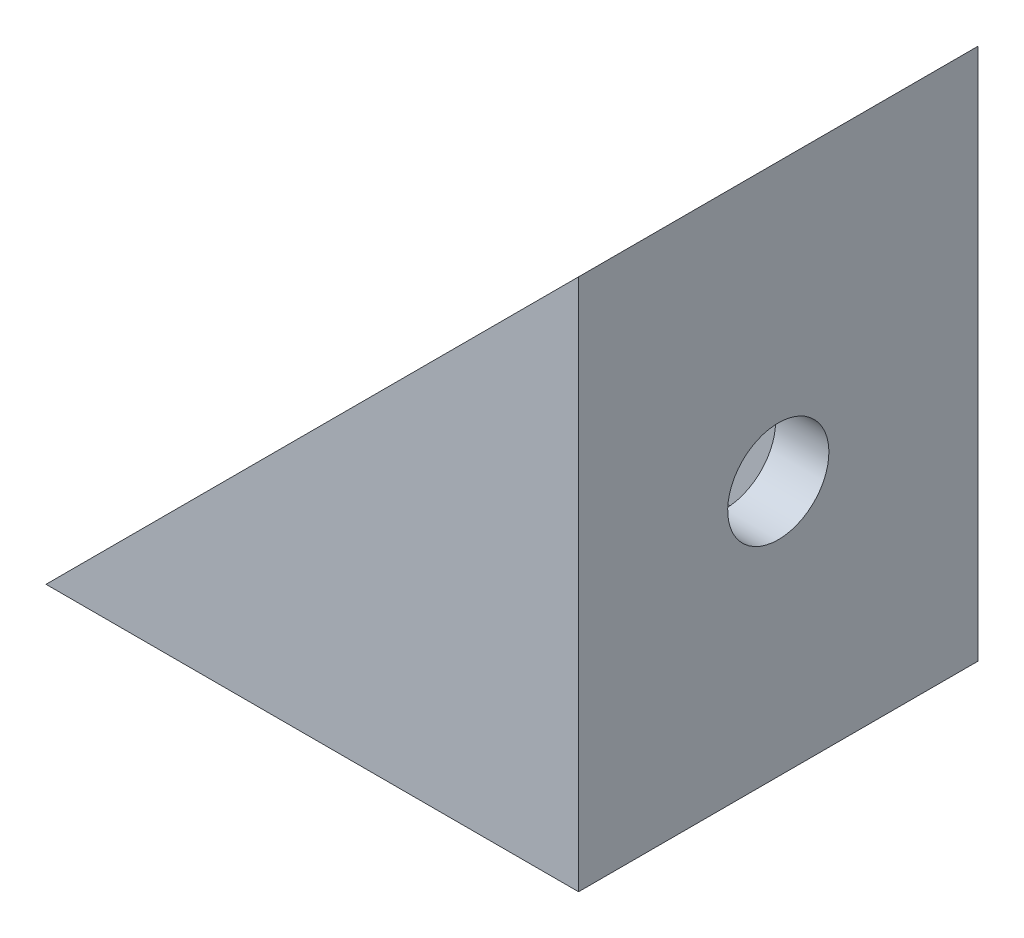
from build123d import *

# Parameters (mm, degrees)
BOSS_EXTRUDE1_DEPTH = 15
CUT_EXTRUDE1_START  = -1.6
CUT_EXTRUDE1_DEPTH  = 11.8
SKETCH3_R           = 1.9
CUT_EXTRUDE2_DEPTH  = 31.805843601
SKETCH4_R           = 1.9
CUT_EXTRUDE3_DEPTH  = 31.805843601


with BuildPart() as part:
    # Sketch1 → Boss-Extrude1 (new body)
    with BuildSketch(Plane.XY):
        Polygon((0, 0), (-20, 0), (0, 20), align=None)
    extrude(amount=BOSS_EXTRUDE1_DEPTH)

    # Sketch2 → Cut-Extrude1 (cut)
    with BuildSketch(Plane.XY.offset(15).offset(CUT_EXTRUDE1_START)):
        Polygon((-18, 2), (-2, 18), (-2, 2), align=None)
    extrude(amount=-CUT_EXTRUDE1_DEPTH, mode=Mode.SUBTRACT)

    # Sketch3 → Cut-Extrude2 (cut, through all)
    with BuildSketch(Plane.ZY.offset(2)):
        with Locations(Location((7.5, 9.6, 0), (0, 0, 270))):
            Circle(SKETCH3_R)
    extrude(amount=-CUT_EXTRUDE2_DEPTH, mode=Mode.SUBTRACT)

    # Sketch4 → Cut-Extrude3 (cut, through all)
    with BuildSketch(Plane(origin=(0, 2, 0), x_dir=(1, 0, 0), z_dir=(0, 1, 0))):
        with Locations(Location((-9.6, -7.5, 0), (0, 0, 180))):
            Circle(SKETCH4_R)
    extrude(amount=-CUT_EXTRUDE3_DEPTH, mode=Mode.SUBTRACT)


solid = part.part
